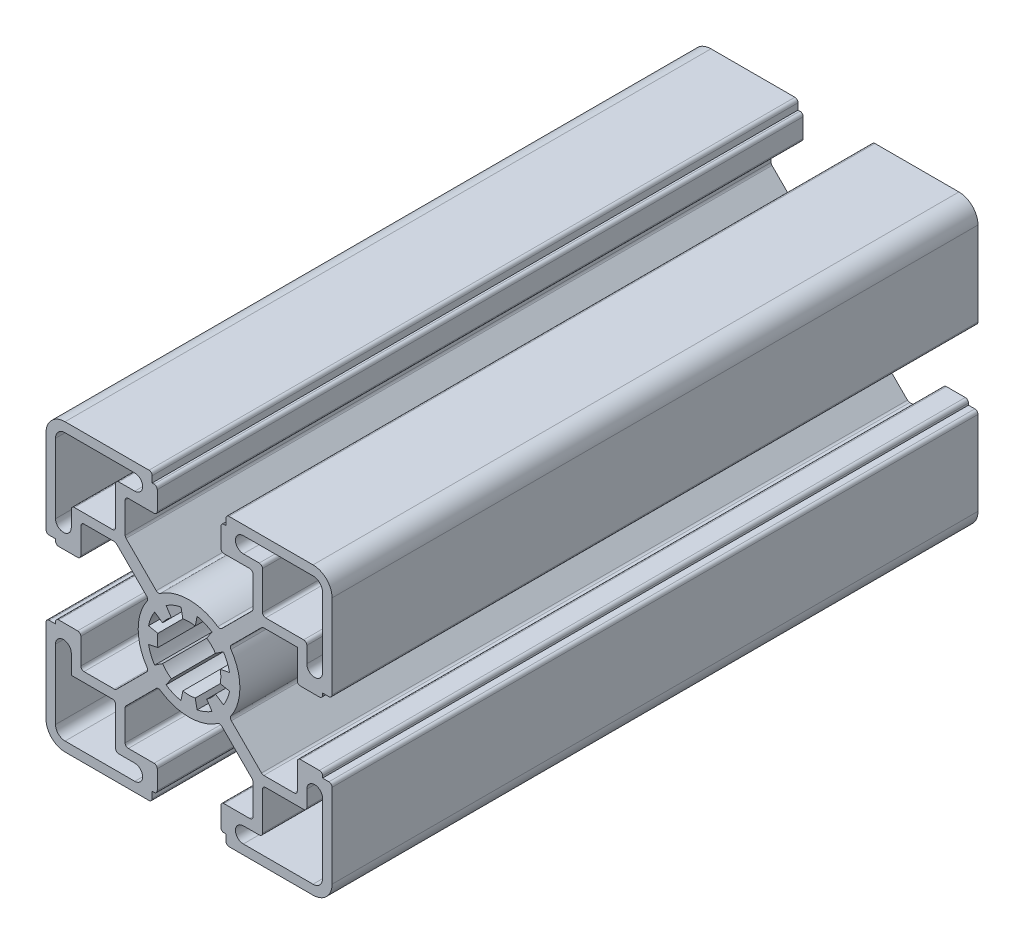
from build123d import *

# Parameters (mm, degrees)
BOSS_EXTRUDE1_DEPTH      = 50.8
BOSS_EXTRUDE1_DEPTH_BACK = 50.8
SKETCH3_R                = 5
FILLET1_R                = 0.5
CUT_EXTRUDE1_DEPTH       = 107.46623878


with BuildPart() as part:
    # Sketch3 → Boss-Extrude1 (new, two sides: drawn at the far end of the back side and taken through both)
    with BuildSketch(Plane.XY.offset(-BOSS_EXTRUDE1_DEPTH_BACK)):
        with BuildLine():
            Line((-11.55, -10.05), (-6.356915373, -4.856915373))
            ThreePointArc((-6.356915373, -4.856915373), (-8, 0), (-6.356915373, 4.856915373))
            Line((-6.356915373, 4.856915373), (-11.55, 10.05))
            Line((-11.55, 10.05), (-17.025, 10.05))
            Line((-17.025, 10.05), (-17.025, 5))
            Line((-17.025, 5), (-21, 5))
            Line((-21, 5), (-21, 5.8))
            Line((-21, 5.8), (-22.5, 5.8))
            Line((-22.5, 5.8), (-22.5, 19.5))
            ThreePointArc((-22.5, 19.5), (-21.621320344, 21.621320344), (-19.5, 22.5))
            Line((-19.5, 22.5), (-5.8, 22.5))
            Line((-5.8, 22.5), (-5.8, 21))
            Line((-5.8, 21), (-5, 21))
            Line((-5, 21), (-5, 17.025))
            Line((-5, 17.025), (-10.05, 17.025))
            Line((-10.05, 17.025), (-10.05, 11.55))
            Line((-10.05, 11.55), (-4.856915373, 6.356915373))
            ThreePointArc((-4.856915373, 6.356915373), (0, 8), (4.856915373, 6.356915373))
            Line((4.856915373, 6.356915373), (10.05, 11.55))
            Line((10.05, 11.55), (10.05, 17.025))
            Line((10.05, 17.025), (5, 17.025))
            Line((5, 17.025), (5, 21))
            Line((5, 21), (5.8, 21))
            Line((5.8, 21), (5.8, 22.5))
            Line((5.8, 22.5), (19.5, 22.5))
            ThreePointArc((19.5, 22.5), (21.621320344, 21.621320344), (22.5, 19.5))
            Line((22.5, 19.5), (22.5, 5.8))
            Line((22.5, 5.8), (21, 5.8))
            Line((21, 5.8), (21, 5))
            Line((21, 5), (17.025, 5))
            Line((17.025, 5), (17.025, 10.05))
            Line((17.025, 10.05), (11.55, 10.05))
            Line((11.55, 10.05), (6.356915373, 4.856915373))
            ThreePointArc((6.356915373, 4.856915373), (8, 0), (6.356915373, -4.856915373))
            Line((6.356915373, -4.856915373), (11.55, -10.05))
            Line((11.55, -10.05), (17.025, -10.05))
            Line((17.025, -10.05), (17.025, -5))
            Line((17.025, -5), (21, -5))
            Line((21, -5), (21, -5.8))
            Line((21, -5.8), (22.5, -5.8))
            Line((22.5, -5.8), (22.5, -19.5))
            ThreePointArc((22.5, -19.5), (21.621320344, -21.621320344), (19.5, -22.5))
            Line((19.5, -22.5), (5.8, -22.5))
            Line((5.8, -22.5), (5.8, -21))
            Line((5.8, -21), (5, -21))
            Line((5, -21), (5, -17.025))
            Line((5, -17.025), (10.05, -17.025))
            Line((10.05, -17.025), (10.05, -11.55))
            Line((10.05, -11.55), (4.856915373, -6.356915373))
            ThreePointArc((4.856915373, -6.356915373), (0, -8), (-4.856915373, -6.356915373))
            Line((-4.856915373, -6.356915373), (-10.05, -11.55))
            Line((-10.05, -11.55), (-10.05, -17.025))
            Line((-10.05, -17.025), (-5, -17.025))
            Line((-5, -17.025), (-5, -21))
            Line((-5, -21), (-5.8, -21))
            Line((-5.8, -21), (-5.8, -22.5))
            Line((-5.8, -22.5), (-19.5, -22.5))
            ThreePointArc((-19.5, -22.5), (-21.621320344, -21.621320344), (-22.5, -19.5))
            Line((-22.5, -19.5), (-22.5, -5.8))
            Line((-22.5, -5.8), (-21, -5.8))
            Line((-21, -5.8), (-21, -5))
            Line((-21, -5), (-17.025, -5))
            Line((-17.025, -5), (-17.025, -10.05))
            Line((-17.025, -10.05), (-11.55, -10.05))
        make_face()
        Circle(SKETCH3_R, mode=Mode.SUBTRACT)
        with BuildLine():
            Line((-21, 8.5375), (-21, 19.5))
            ThreePointArc((-21, 19.5), (-20.560660172, 20.560660172), (-19.5, 21))
            Line((-19.5, 21), (-8.5375, 21))
            ThreePointArc((-8.5375, 21), (-7.3, 19.7625), (-8.5375, 18.525))
            Line((-8.5375, 18.525), (-11.55, 18.525))
            Line((-11.55, 18.525), (-11.55, 11.55))
            Line((-11.55, 11.55), (-18.525, 11.55))
            Line((-18.525, 11.55), (-18.525, 8.5375))
            ThreePointArc((-18.525, 8.5375), (-19.7625, 7.3), (-21, 8.5375))
        make_face(mode=Mode.SUBTRACT)
        with BuildLine():
            Line((8.5375, 21), (19.5, 21))
            ThreePointArc((19.5, 21), (20.560660172, 20.560660172), (21, 19.5))
            Line((21, 19.5), (21, 8.5375))
            ThreePointArc((21, 8.5375), (19.7625, 7.3), (18.525, 8.5375))
            Line((18.525, 8.5375), (18.525, 11.55))
            Line((18.525, 11.55), (11.55, 11.55))
            Line((11.55, 11.55), (11.55, 18.525))
            Line((11.55, 18.525), (8.5375, 18.525))
            ThreePointArc((8.5375, 18.525), (7.3, 19.7625), (8.5375, 21))
        make_face(mode=Mode.SUBTRACT)
        with BuildLine():
            Line((21, -8.5375), (21, -19.5))
            ThreePointArc((21, -19.5), (20.560660172, -20.560660172), (19.5, -21))
            Line((19.5, -21), (8.5375, -21))
            ThreePointArc((8.5375, -21), (7.3, -19.7625), (8.5375, -18.525))
            Line((8.5375, -18.525), (11.55, -18.525))
            Line((11.55, -18.525), (11.55, -11.55))
            Line((11.55, -11.55), (18.525, -11.55))
            Line((18.525, -11.55), (18.525, -8.5375))
            ThreePointArc((18.525, -8.5375), (19.7625, -7.3), (21, -8.5375))
        make_face(mode=Mode.SUBTRACT)
        with BuildLine():
            Line((-8.5375, -21), (-19.5, -21))
            ThreePointArc((-19.5, -21), (-20.560660172, -20.560660172), (-21, -19.5))
            Line((-21, -19.5), (-21, -8.5375))
            ThreePointArc((-21, -8.5375), (-19.7625, -7.3), (-18.525, -8.5375))
            Line((-18.525, -8.5375), (-18.525, -11.55))
            Line((-18.525, -11.55), (-11.55, -11.55))
            Line((-11.55, -11.55), (-11.55, -18.525))
            Line((-11.55, -18.525), (-8.5375, -18.525))
            ThreePointArc((-8.5375, -18.525), (-7.3, -19.7625), (-8.5375, -21))
        make_face(mode=Mode.SUBTRACT)
    extrude(amount=BOSS_EXTRUDE1_DEPTH + BOSS_EXTRUDE1_DEPTH_BACK)

    # Fillet1
    fillet1_edges = [part.edges().sort_by_distance(p)[0] for p in [
        (-11.55, -18.525, 0),
        (-11.55, -11.55, 0),
        (18.525, -11.55, 0),
        (11.55, -11.55, 0),
        (11.55, -18.525, 0),
        (11.55, 18.525, 0),
        (11.55, 11.55, 0),
        (18.525, 11.55, 0),
        (-18.525, 11.55, 0),
        (-11.55, 11.55, 0),
        (-11.55, 18.525, 0),
        (6.356915373, -4.856915373, 0),
        (11.55, -10.05, 0),
        (17.025, -10.05, 0),
        (17.025, -5, 0),
        (21, -5, 0),
        (22.5, -5.8, 0),
        (5.8, -22.5, 0),
        (5, -21, 0),
        (5, -17.025, 0),
        (10.05, -17.025, 0),
        (10.05, -11.55, 0),
        (4.856915373, -6.356915373, 0),
        (-4.856915373, -6.356915373, 0),
        (-10.05, -11.55, 0),
        (-10.05, -17.025, 0),
        (-5, -17.025, 0),
        (-5, -21, 0),
        (-5.8, -22.5, 0),
        (-22.5, -5.8, 0),
        (-21, -5, 0),
        (-17.025, -5, 0),
        (-17.025, -10.05, 0),
        (-11.55, -10.05, 0),
        (-6.356915373, -4.856915373, 0),
        (-6.356915373, 4.856915373, 0),
        (-11.55, 10.05, 0),
        (-17.025, 10.05, 0),
        (-17.025, 5, 0),
        (-21, 5, 0),
        (-22.5, 5.8, 0),
        (-5.8, 22.5, 0),
        (-5, 21, 0),
        (-5, 17.025, 0),
        (-10.05, 17.025, 0),
        (-10.05, 11.55, 0),
        (-4.856915373, 6.356915373, 0),
        (4.856915373, 6.356915373, 0),
        (10.05, 11.55, 0),
        (10.05, 17.025, 0),
        (5, 17.025, 0),
        (5, 21, 0),
        (5.8, 22.5, 0),
        (22.5, 5.8, 0),
        (21, 5, 0),
        (17.025, 5, 0),
        (11.55, 10.05, 0),
        (6.356915373, 4.856915373, 0),
    ]]
    fillet(fillet1_edges, radius=FILLET1_R)

    # Sketch4 → Cut-Extrude1 (cut, through all)
    with BuildSketch(Plane.XY.offset(50.8)):
        with BuildLine():
            Line((-1.268087093, 6.375104323), (-0.97545161, 4.903926402))
            ThreePointArc((-0.97545161, 4.903926402), (-1.913417162, 4.619397663), (-2.777851165, 4.157348062))
            Line((-2.777851165, 4.157348062), (-3.611206515, 5.40455248))
            ThreePointArc((-3.611206515, 5.40455248), (-2.48744231, 6.005216961), (-1.268087093, 6.375104323))
        make_face()
        with BuildLine():
            Line((1.268087093, 6.375104323), (0.97545161, 4.903926402))
            ThreePointArc((0.97545161, 4.903926402), (1.913417162, 4.619397663), (2.777851165, 4.157348062))
            Line((2.777851165, 4.157348062), (3.611206515, 5.40455248))
            ThreePointArc((3.611206515, 5.40455248), (2.48744231, 6.005216961), (1.268087093, 6.375104323))
        make_face()
        with BuildLine():
            Line((5.40455248, 3.611206515), (4.157348062, 2.777851165))
            ThreePointArc((4.157348062, 2.777851165), (4.619397663, 1.913417162), (4.903926402, 0.97545161))
            Line((4.903926402, 0.97545161), (6.375104323, 1.268087093))
            ThreePointArc((6.375104323, 1.268087093), (6.005216961, 2.48744231), (5.40455248, 3.611206515))
        make_face()
        with BuildLine():
            Line((6.375104323, -1.268087093), (4.903926402, -0.97545161))
            ThreePointArc((4.903926402, -0.97545161), (4.619397663, -1.913417162), (4.157348062, -2.777851165))
            Line((4.157348062, -2.777851165), (5.40455248, -3.611206515))
            ThreePointArc((5.40455248, -3.611206515), (6.005216961, -2.48744231), (6.375104323, -1.268087093))
        make_face()
        with BuildLine():
            Line((3.611206515, -5.40455248), (2.777851165, -4.157348062))
            ThreePointArc((2.777851165, -4.157348062), (1.913417162, -4.619397663), (0.97545161, -4.903926402))
            Line((0.97545161, -4.903926402), (1.268087093, -6.375104323))
            ThreePointArc((1.268087093, -6.375104323), (2.48744231, -6.005216961), (3.611206515, -5.40455248))
        make_face()
        with BuildLine():
            Line((-1.268087093, -6.375104323), (-0.97545161, -4.903926402))
            ThreePointArc((-0.97545161, -4.903926402), (-1.913417162, -4.619397663), (-2.777851165, -4.157348062))
            Line((-2.777851165, -4.157348062), (-3.611206515, -5.40455248))
            ThreePointArc((-3.611206515, -5.40455248), (-2.48744231, -6.005216961), (-1.268087093, -6.375104323))
        make_face()
        with BuildLine():
            Line((-5.40455248, -3.611206515), (-4.157348062, -2.777851165))
            ThreePointArc((-4.157348062, -2.777851165), (-4.619397663, -1.913417162), (-4.903926402, -0.97545161))
            Line((-4.903926402, -0.97545161), (-6.375104323, -1.268087093))
            ThreePointArc((-6.375104323, -1.268087093), (-6.005216961, -2.48744231), (-5.40455248, -3.611206515))
        make_face()
        with BuildLine():
            Line((-6.375104323, 1.268087093), (-4.903926402, 0.97545161))
            ThreePointArc((-4.903926402, 0.97545161), (-4.619397663, 1.913417162), (-4.157348062, 2.777851165))
            Line((-4.157348062, 2.777851165), (-5.40455248, 3.611206515))
            ThreePointArc((-5.40455248, 3.611206515), (-6.005216961, 2.48744231), (-6.375104323, 1.268087093))
        make_face()
    extrude(amount=-CUT_EXTRUDE1_DEPTH, mode=Mode.SUBTRACT)


solid = part.part
